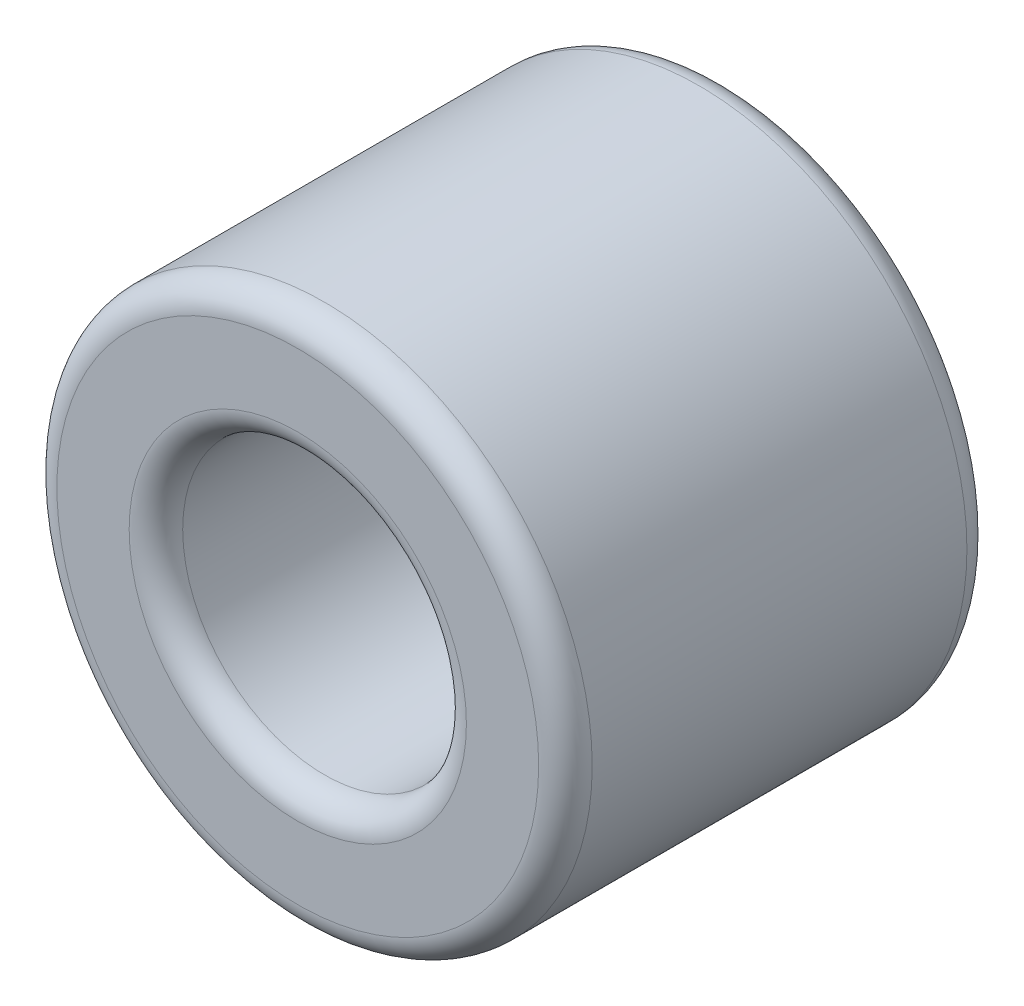
from build123d import *

# Parameters (mm, degrees)
SKETCH1_R    = 5
SKETCH1_R_2  = 2.65
SPACER_DEPTH = 8
FILLET1_R    = 0.5


with BuildPart() as part:
    # Sketch1 → spacer (new body)
    with BuildSketch(Plane.XY):
        Circle(SKETCH1_R)
        Circle(SKETCH1_R_2, mode=Mode.SUBTRACT)
    extrude(amount=SPACER_DEPTH)

    # Fillet1
    fillet1_edges = [part.edges().sort_by_distance(p)[0] for p in [
        (-5, 0, 0),
        (-5, 0, 8),
        (-2.65, 0, 0),
        (-2.65, 0, 8),
    ]]
    fillet(fillet1_edges, radius=FILLET1_R)


solid = part.part
